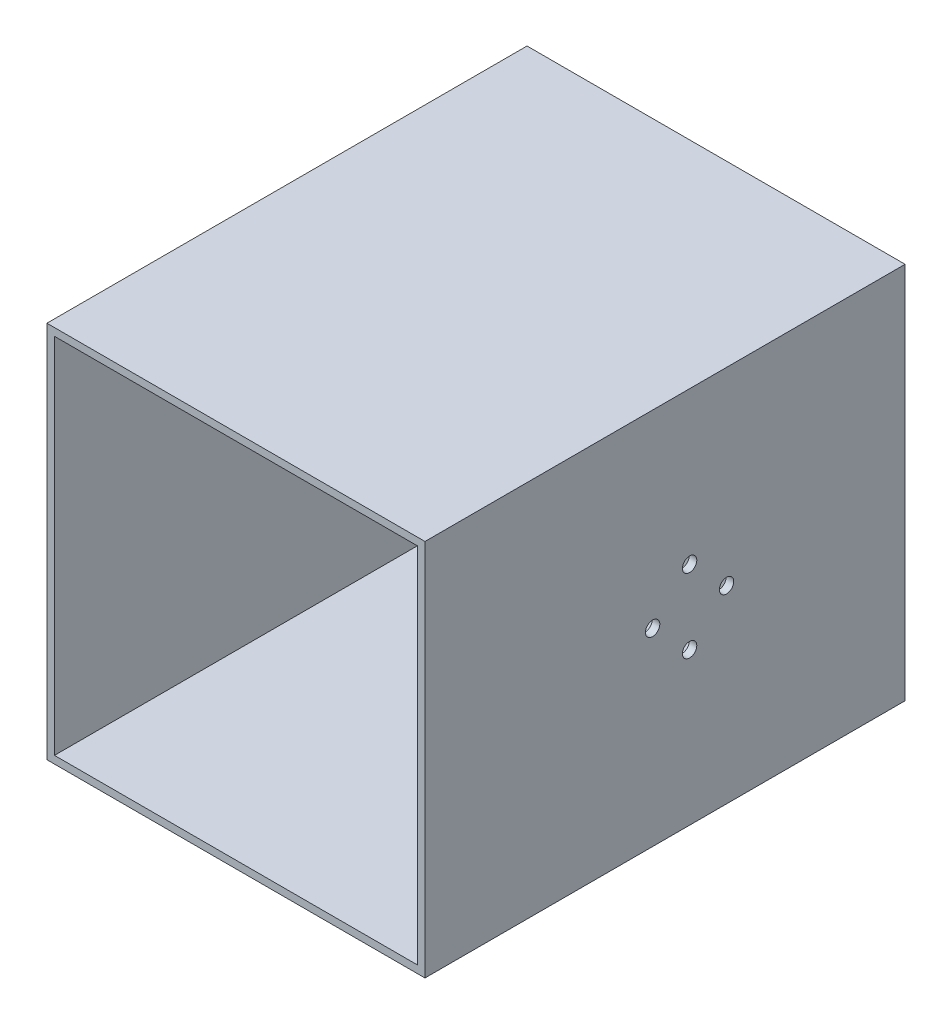
from build123d import *

# Parameters (mm, degrees)
SKETCH1_W               = 100
SKETCH1_H               = 100
BOSS_EXTRUDE2_DEPTH     = 2
SKETCH2_W               = 100
SKETCH2_H               = 100
SKETCH2_W_2             = 96
SKETCH2_H_2             = 96
BOSS_EXTRUDE4_DEPTH     = 125
CUT_EXTRUDE1_DEPTH      = 196.282511518
CUT_EXTRUDE1_DEPTH_BACK = 196.282511518
SKETCH3_R               = 1.9


with BuildPart() as part:
    # Sketch1 → Boss-Extrude2 (new body)
    with BuildSketch(Plane.XY):
        with Locations((119.248829914, 59.573077464)):
            Rectangle(SKETCH1_W, SKETCH1_H)
    extrude(amount=BOSS_EXTRUDE2_DEPTH)

    # Sketch2 → Boss-Extrude4 (add)
    with BuildSketch(Plane.XY.offset(2)):
        with Locations((119.248829914, 59.573077464)):
            Rectangle(SKETCH2_W, SKETCH2_H)
        with Locations((119.248829914, 59.573077464)):
            Rectangle(SKETCH2_W_2, SKETCH2_H_2, mode=Mode.SUBTRACT)
    extrude(amount=BOSS_EXTRUDE4_DEPTH)

    # Sketch3 → Cut-Extrude1 (cut, two sides: drawn at the far end of the back side and taken through both)
    with BuildSketch(Plane(origin=(169.248829914, 0, 0), x_dir=(0, 0, -1), z_dir=(1, 0, 0)).offset(-CUT_EXTRUDE1_DEPTH_BACK)):
        with Locations(Location((-57, 69.352077464, 0), (0, 0, 270))):
            Circle(SKETCH3_R)
        with Locations(Location((-47.221, 59.573077464, 0), (0, 0, 270))):
            Circle(SKETCH3_R)
        with Locations(Location((-57, 49.794077464, 0), (0, 0, 270))):
            Circle(SKETCH3_R)
        with Locations(Location((-66.779, 59.573077464, 0), (0, 0, 270))):
            Circle(SKETCH3_R)
    extrude(amount=CUT_EXTRUDE1_DEPTH + CUT_EXTRUDE1_DEPTH_BACK, mode=Mode.SUBTRACT)


solid = part.part
